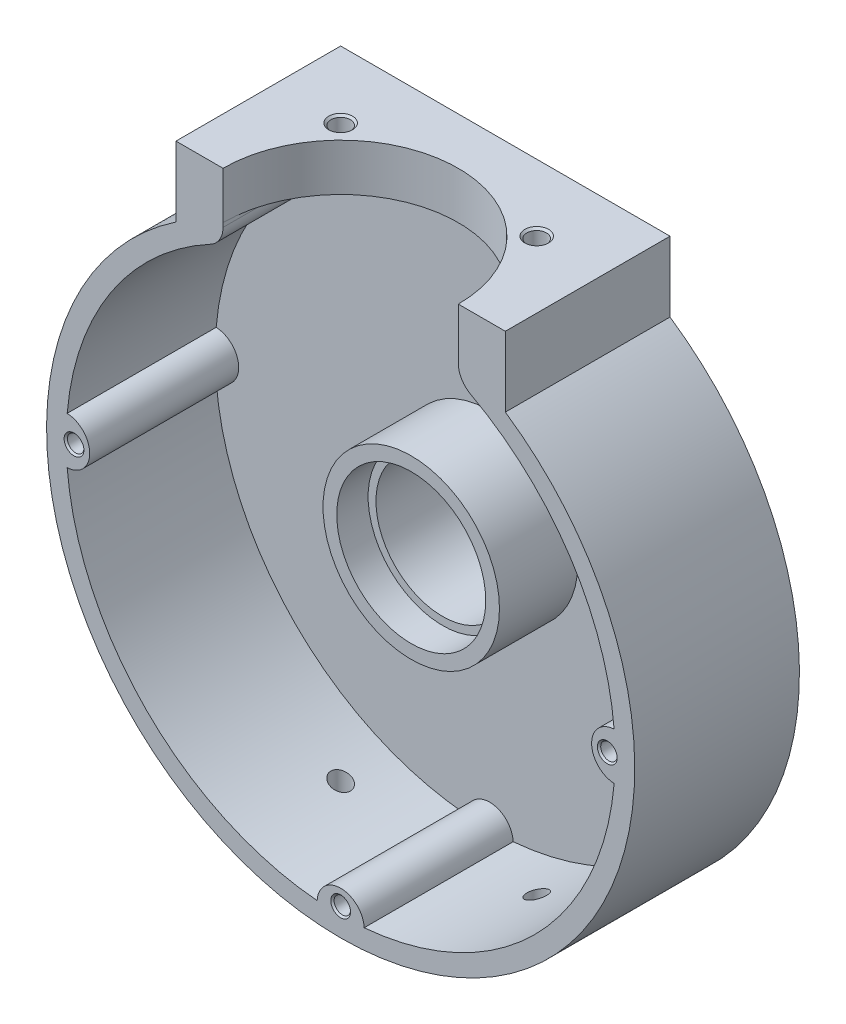
from build123d import *

# Parameters (mm, degrees)
EXTRUDE_1_DEPTH              = 42
CUT_EXTRUDE_1_DEPTH          = 38
HOLE_WIZARD_M5_1_D           = 4.2
HOLE_WIZARD_M5_1_CSINK_D     = 5.05
HOLE_WIZARD_M5_1_CSINK_ANGLE = 90
PATTERN_CIRCULAR_1_COUNT     = 4
CUT_EXTRUDE_3_REACH          = 119.427
SKETCH_6_R                   = 30
HOLE_WIZARD_M6_1_D           = 5
HOLE_WIZARD_M6_1_CSINK_D     = 6.05
HOLE_WIZARD_M6_1_CSINK_ANGLE = 90
SKETCH_9_W                   = 91
SKETCH_9_H                   = 91
EXTRUDE_2_DEPTH              = 23
EXTRUDE_2_TAPER              = 45
SKETCH_10_R                  = 22.5
EXTRUDE_3_DEPTH              = 20
SKETCH_11_R                  = 19
CUT_EXTRUDE_4_DEPTH          = 8
SKETCH_12_R                  = 17
CUT_EXTRUDE_5_DEPTH          = 32


with BuildPart() as part:
    # 草图1 → 凸台-拉伸1 (new body)
    with BuildSketch(Plane.XY):
        with BuildLine():
            Line((-42, 62.136945532), (-42, 80))
            Line((-42, 80), (42, 80))
            Line((42, 80), (42, 62.136945532))
            ThreePointArc((42, 62.136945532), (0, -75), (-42, 62.136945532))
        make_face()
    extrude(amount=EXTRUDE_1_DEPTH)

    # 草图2 → 切除-拉伸1 (cut)
    with BuildSketch(Plane.XY.offset(42)):
        with BuildLine():
            Line((-30, 66.932802123), (-30, 68))
            Line((-30, 68), (30, 68))
            Line((30, 68), (30, 66.932802123))
            ThreePointArc((30, 66.932802123), (30.849629548, 63.854867066), (33.157894737, 61.648633534))
            ThreePointArc((33.157894737, 61.648633534), (58.493479839, 38.451434516), (69.742857143, 5.994487263))
            ThreePointArc((69.742857143, 5.994487263), (64, 0), (69.742857143, -5.994487263))
            ThreePointArc((69.742857143, -5.994487263), (49.497474683, -49.497474683), (5.994487263, -69.742857143))
            ThreePointArc((5.994487263, -69.742857143), (0, -64), (-5.994487263, -69.742857143))
            ThreePointArc((-5.994487263, -69.742857143), (-49.497474683, -49.497474683), (-69.742857143, -5.994487263))
            ThreePointArc((-69.742857143, -5.994487263), (-64, 0), (-69.742857143, 5.994487263))
            ThreePointArc((-69.742857143, 5.994487263), (-58.493479839, 38.451434516), (-33.157894737, 61.648633534))
            ThreePointArc((-33.157894737, 61.648633534), (-30.849629548, 63.854867066), (-30, 66.932802123))
        make_face()
    extrude(amount=-CUT_EXTRUDE_1_DEPTH, mode=Mode.SUBTRACT)

    # M5 螺纹孔1 (through all)
    with Locations(Plane.XY.offset(42)):
        with Locations((0, -68)):
            hole_wizard_m5_1 = CounterSinkHole(HOLE_WIZARD_M5_1_D / 2, HOLE_WIZARD_M5_1_CSINK_D / 2, counter_sink_angle=HOLE_WIZARD_M5_1_CSINK_ANGLE)

    # 阵列(圆周)1: M5 螺纹孔1 ×4 about axis, 1 skipped
    pattern_circular_1_axis = Axis((0, 0, 0), (0, 0, -1))
    add([hole_wizard_m5_1.rotate(pattern_circular_1_axis, i * 360 / PATTERN_CIRCULAR_1_COUNT) for i in range(1, PATTERN_CIRCULAR_1_COUNT) if i not in (2,)], mode=Mode.SUBTRACT)

    # 草图6 → 切除-拉伸3 (cut, up to next)
    with BuildSketch(Plane(origin=(0, 0, 0), x_dir=(1, 0, 0), z_dir=(0, 1, 0)), mode=Mode.PRIVATE) as cut_extrude_3_sk1:
        with Locations((0, -42)):
            Circle(SKETCH_6_R)
    cut_extrude_3_tool1 = extrude(cut_extrude_3_sk1.sketch, amount=CUT_EXTRUDE_3_REACH, mode=Mode.PRIVATE) & part.part
    add(cut_extrude_3_tool1.solids().sort_by_distance((0, 0, 42))[0], mode=Mode.SUBTRACT)

    # M6 螺纹孔1 (through all)
    with Locations(Plane(origin=(0, 80, 0), x_dir=(1, 0, 0), z_dir=(0, 1, 0))):
        with Locations((25, -17), (-25, -17)):
            CounterSinkHole(HOLE_WIZARD_M6_1_D / 2, HOLE_WIZARD_M6_1_CSINK_D / 2, counter_sink_angle=HOLE_WIZARD_M6_1_CSINK_ANGLE)

    # 草图9 → 凸台-拉伸2 (add)
    with BuildSketch(Plane(origin=(0, 0, 0), x_dir=(-1, 0, 0), z_dir=(0, 0, -1))):
        Rectangle(SKETCH_9_W, SKETCH_9_H)
    extrude(amount=EXTRUDE_2_DEPTH, taper=EXTRUDE_2_TAPER)

    # 草图10 → 凸台-拉伸3 (add)
    with BuildSketch(Plane.XY.offset(4)):
        Circle(SKETCH_10_R)
    extrude(amount=EXTRUDE_3_DEPTH)

    # 草图11 → 切除-拉伸4 (cut)
    with BuildSketch(Plane.XY.offset(24)):
        Circle(SKETCH_11_R)
    extrude(amount=-CUT_EXTRUDE_4_DEPTH, mode=Mode.SUBTRACT)

    # 草图12 → 切除-拉伸5 (cut)
    with BuildSketch(Plane.XY.offset(16)):
        Circle(SKETCH_12_R)
    extrude(amount=-CUT_EXTRUDE_5_DEPTH, mode=Mode.SUBTRACT)


solid = part.part
